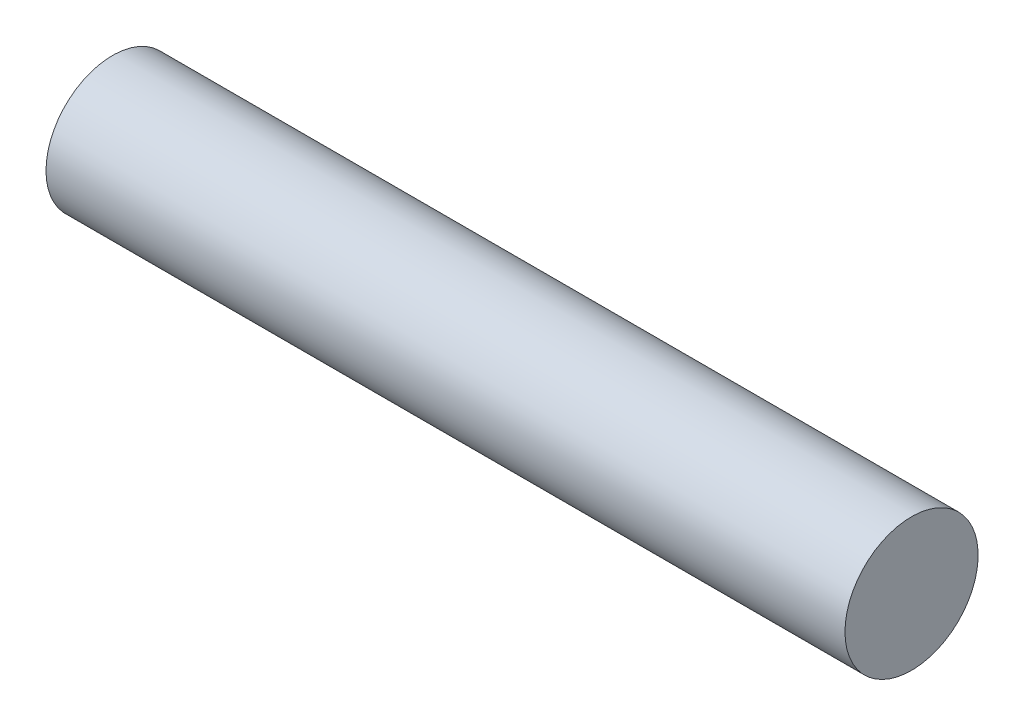
from build123d import *

# Parameters (mm, degrees)
SKETCH1_R           = 6.35
BOSS_EXTRUDE1_DEPTH = 76.2


with BuildPart() as part:
    # Sketch1 → Boss-Extrude1 (new body)
    with BuildSketch(Plane(origin=(0, 0, 0), x_dir=(0, 0, -1), z_dir=(1, 0, 0))):
        with Locations(Location((0, 0, 0), (0, 0, 180))):
            Circle(SKETCH1_R)
    extrude(amount=BOSS_EXTRUDE1_DEPTH)


solid = part.part
